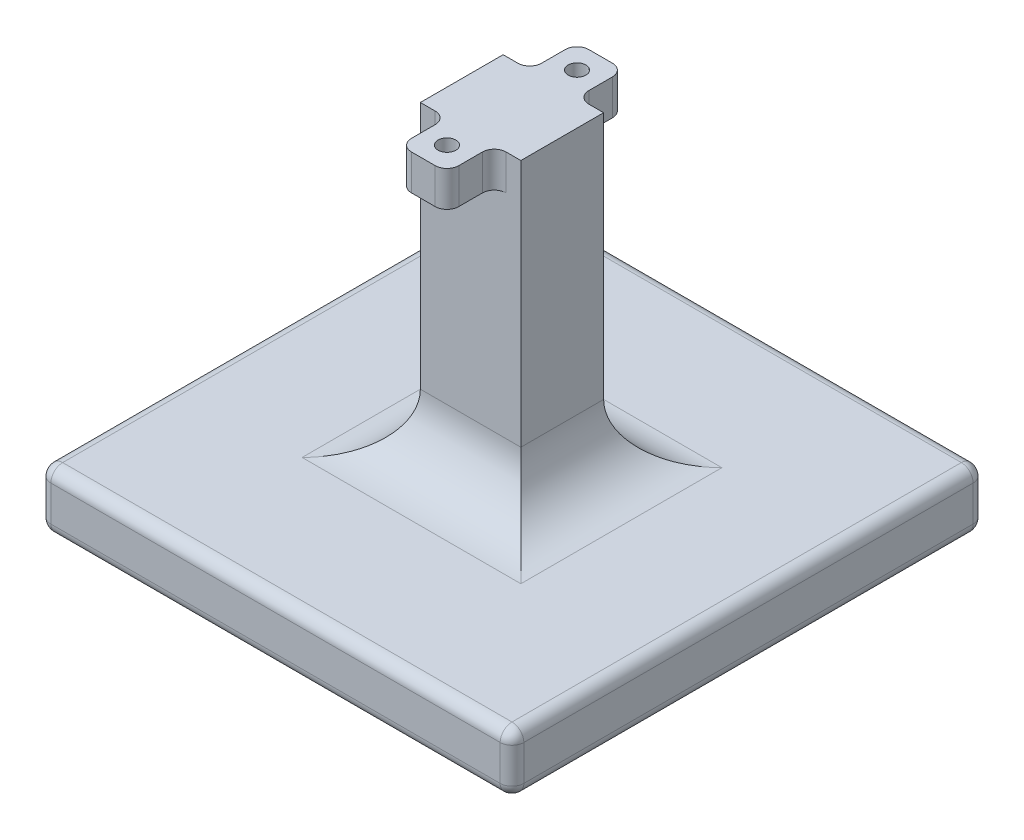
from build123d import *

# Parameters (mm, degrees)
SKETCH1_W           = 17
SKETCH1_H           = 14
BOSS_EXTRUDE1_DEPTH = 52
SKETCH2_W           = 80
SKETCH2_H           = 80
BOSS_EXTRUDE2_DEPTH = 10
SKETCH3_W           = 8
SKETCH3_H           = 8
SKETCH3_R           = 1.5
BOSS_EXTRUDE3_DEPTH = 6
FILLET1_R           = 2
FILLET2_R           = 10
SKETCH4_R           = 3
BOSS_EXTRUDE4_DEPTH = 2
FILLET4_R           = 1
FILLET3_R           = 2


with BuildPart() as part:
    # Sketch1 → Boss-Extrude1 (new body)
    with BuildSketch(Plane(origin=(0, 0, 0), x_dir=(1, 0, 0), z_dir=(0, 1, 0))):
        with Locations((8.5, -7)):
            Rectangle(SKETCH1_W, SKETCH1_H)
    extrude(amount=BOSS_EXTRUDE1_DEPTH)

    # Sketch2 → Boss-Extrude2 (add)
    with BuildSketch(Plane.XZ):
        with Locations((8.5, 7)):
            Rectangle(SKETCH2_W, SKETCH2_H)
    extrude(amount=BOSS_EXTRUDE2_DEPTH)

    # Sketch3 → Boss-Extrude3 (add)
    # profile 1 of 2: a face of its own
    with BuildSketch(Plane(origin=(0, 52, 0), x_dir=(1, 0, 0), z_dir=(0, 1, 0))):
        with Locations((8.5, 4)):
            Rectangle(SKETCH3_W, SKETCH3_H)
        with Locations(Location((8.5, 4, 0), (0, 0, 270))):
            Circle(SKETCH3_R, mode=Mode.SUBTRACT)
    # profile 2 of 2: a face of its own
    with BuildSketch(Plane(origin=(0, 52, 0), x_dir=(1, 0, 0), z_dir=(0, 1, 0))):
        with Locations((8.5, -18)):
            Rectangle(SKETCH3_W, SKETCH3_H)
        with Locations(Location((8.5, -18, 0), (0, 0, 90))):
            Circle(SKETCH3_R, mode=Mode.SUBTRACT)
    extrude(amount=-BOSS_EXTRUDE3_DEPTH)

    # Fillet1
    fillet1_edges = [part.edges().sort_by_distance(p)[0] for p in [
        (4.5, 49, 0),
        (4.5, 49, -8),
        (12.5, 49, -8),
        (12.5, 49, 0),
        (4.5, 49, 22),
        (4.5, 49, 14),
        (12.5, 49, 14),
        (12.5, 49, 22),
    ]]
    fillet(fillet1_edges, radius=FILLET1_R)

    # Fillet2
    fillet2_edges = [part.edges().sort_by_distance(p)[0] for p in [
        (8.5, 0, 0),
        (17, 0, 7),
        (8.5, 0, 14),
        (0, 0, 7),
    ]]
    fillet(fillet2_edges, radius=FILLET2_R)

    # Sketch4 → Boss-Extrude4 (add)
    with BuildSketch(Plane.XZ.offset(10)):
        with Locations(Location((-25.5, 41, 0), (0, 0, 270))):
            Circle(SKETCH4_R)
        with Locations(Location((-25.5, -27, 0), (0, 0, 90))):
            Circle(SKETCH4_R)
        with Locations(Location((42.5, -27, 0), (0, 0, 270))):
            Circle(SKETCH4_R)
        with Locations(Location((42.5, 41, 0), (0, 0, 90))):
            Circle(SKETCH4_R)
    extrude(amount=BOSS_EXTRUDE4_DEPTH)

    # Fillet4
    fillet4_edges = [part.edges().sort_by_distance(p)[0] for p in [
        (-25.5, -12, 44),
        (-25.5, -12, -30),
        (42.5, -12, -24),
        (42.5, -12, 38),
    ]]
    fillet(fillet4_edges, radius=FILLET4_R)

    # Fillet3
    fillet3_edges = [part.edges().sort_by_distance(p)[0] for p in [
        (-31.5, 0, 7),
        (-31.5, -5, 47),
        (8.5, 0, -33),
        (-31.5, -5, -33),
        (48.5, 0, 7),
        (48.5, -5, -33),
        (8.5, 0, 47),
        (48.5, -5, 47),
        (-31.5, -10, 7),
        (8.5, -10, -33),
        (48.5, -10, 7),
        (8.5, -10, 47),
    ]]
    fillet(fillet3_edges, radius=FILLET3_R)


solid = part.part
